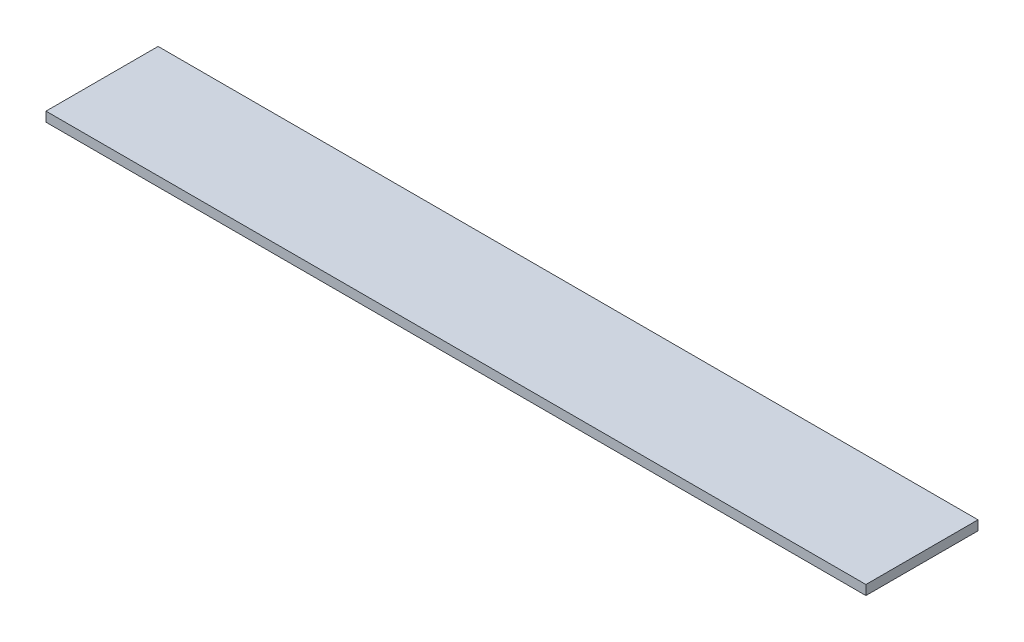
from build123d import *

# Parameters (mm, degrees)
SKETCH1_W           = 128
SKETCH1_H           = 17.5
BOSS_EXTRUDE1_DEPTH = 1.5


with BuildPart() as part:
    # Sketch1 → Boss-Extrude1 (new body)
    with BuildSketch(Plane(origin=(0, 0, 0), x_dir=(1, 0, 0), z_dir=(0, 1, 0))):
        Rectangle(SKETCH1_W, SKETCH1_H)
    extrude(amount=BOSS_EXTRUDE1_DEPTH)


solid = part.part
